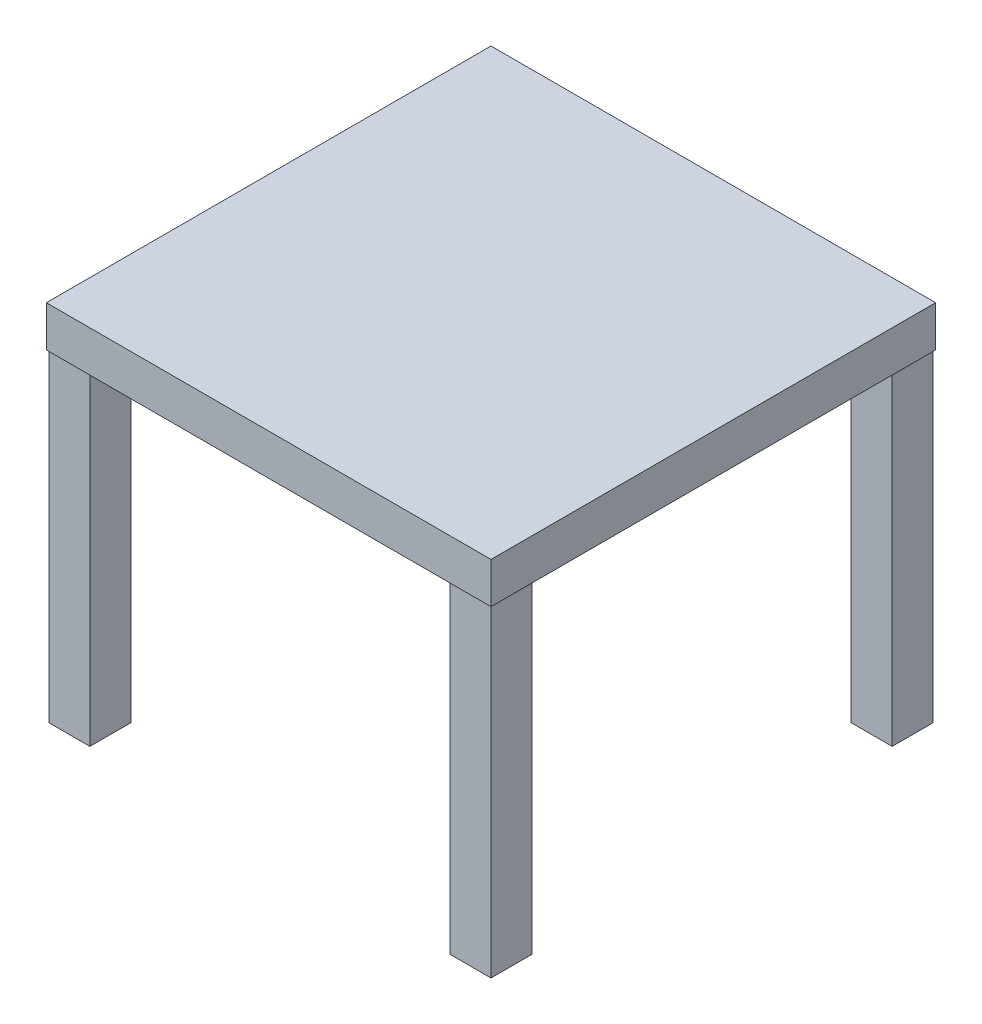
from build123d import *

# Parameters (mm, degrees)
SKETCH1_W           = 550
SKETCH1_H           = 550
BOSS_EXTRUDE1_DEPTH = 50.6
SKETCH3_W           = 50.6
SKETCH3_H           = 50.6
BOSS_EXTRUDE2_DEPTH = 399.4


with BuildPart() as part:
    # Sketch1 → Boss-Extrude1 (new body)
    with BuildSketch(Plane(origin=(0, 0, 0), x_dir=(1, 0, 0), z_dir=(0, 1, 0))):
        Rectangle(SKETCH1_W, SKETCH1_H)
    extrude(amount=BOSS_EXTRUDE1_DEPTH)

    # Sketch3 → Boss-Extrude2 (add)
    with BuildSketch(Plane.XZ):
        with Locations((248.1, -248.1)):
            Rectangle(SKETCH3_W, SKETCH3_H)
        with Locations((-248.1, -248.1)):
            Rectangle(SKETCH3_W, SKETCH3_H)
        with Locations((-248.1, 248.1)):
            Rectangle(SKETCH3_W, SKETCH3_H)
        with Locations((248.1, 248.1)):
            Rectangle(SKETCH3_W, SKETCH3_H)
    extrude(amount=BOSS_EXTRUDE2_DEPTH)


solid = part.part
